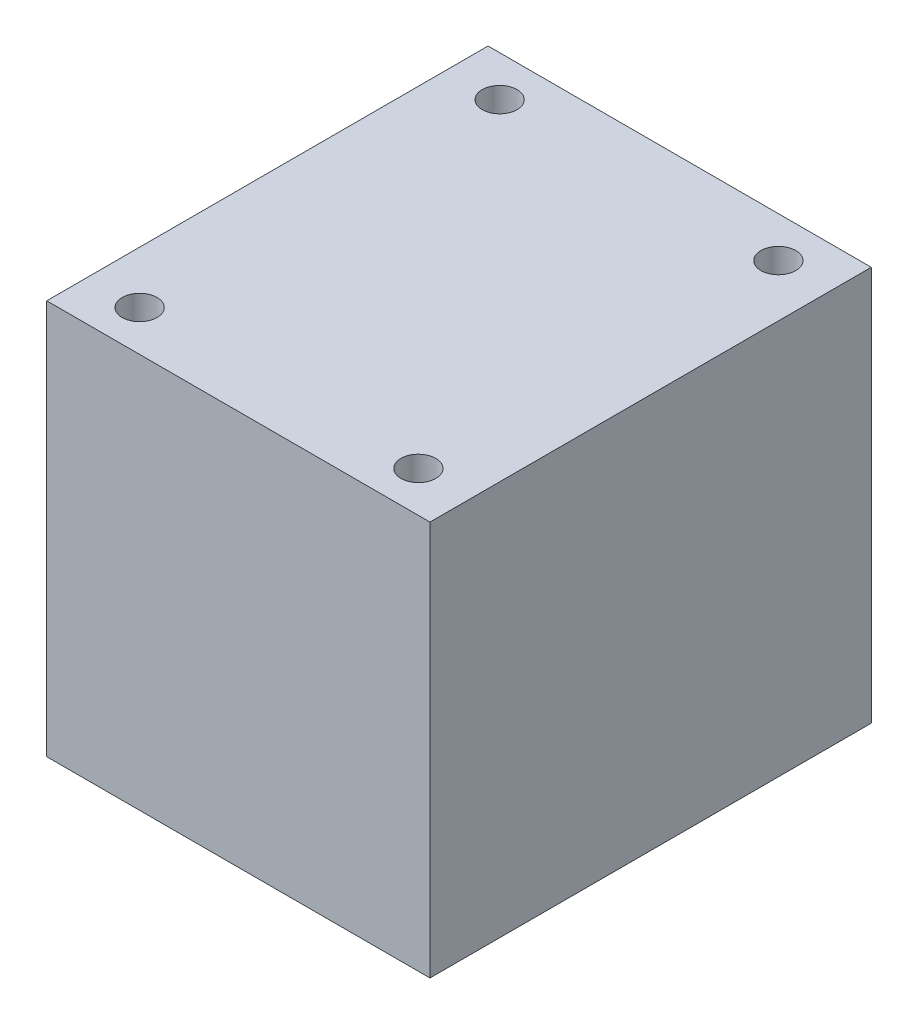
from build123d import *

# Parameters (mm, degrees)
SKETCH1_W           = 33
SKETCH1_H           = 38
SKETCH1_R           = 1.5
BOSS_EXTRUDE1_DEPTH = 34


with BuildPart() as part:
    # Sketch1 → Boss-Extrude1 (new body)
    with BuildSketch(Plane(origin=(0, 0, 0), x_dir=(1, 0, 0), z_dir=(0, 1, 0))):
        with Locations((16.5, -19)):
            Rectangle(SKETCH1_W, SKETCH1_H)
        with Locations(Location((28.5, -3.5, 0), (0, 0, 270))):
            Circle(SKETCH1_R, mode=Mode.SUBTRACT)
        with Locations(Location((28.5, -34.5, 0), (0, 0, 270))):
            Circle(SKETCH1_R, mode=Mode.SUBTRACT)
        with Locations(Location((4.5, -34.5, 0), (0, 0, 270))):
            Circle(SKETCH1_R, mode=Mode.SUBTRACT)
        with Locations(Location((4.5, -3.5, 0), (0, 0, 270))):
            Circle(SKETCH1_R, mode=Mode.SUBTRACT)
    extrude(amount=BOSS_EXTRUDE1_DEPTH)


solid = part.part
